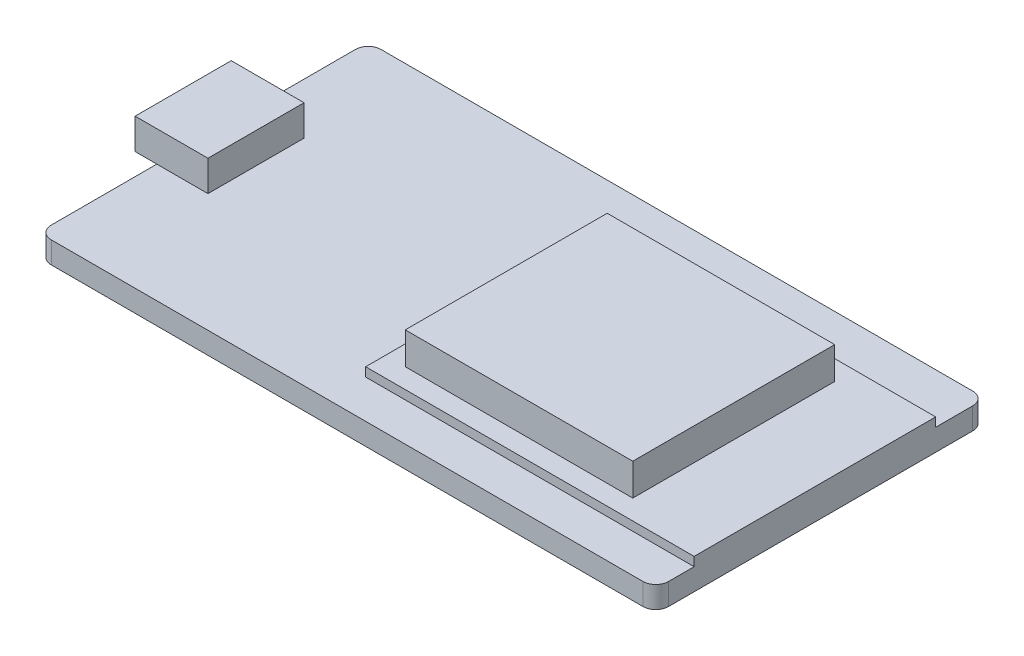
from build123d import *

# Parameters (mm, degrees)
CROQUIS1_W              = 48.3
CROQUIS1_H              = 25.8
SALIENTE_EXTRUIR1_DEPTH = 1.7
CROQUIS2_W              = 25.7
CROQUIS2_H              = 18.9
SALIENTE_EXTRUIR2_DEPTH = 0.7
CROQUIS3_W              = 17.8
CROQUIS3_H              = 15.8
SALIENTE_EXTRUIR3_DEPTH = 2.5
CROQUIS4_W              = 5.7
CROQUIS4_H              = 7.52
SALIENTE_EXTRUIR4_DEPTH = 2.4
REDONDEO1_R             = 1


with BuildPart() as part:
    # Croquis1 → Saliente-Extruir1 (new body)
    with BuildSketch(Plane(origin=(0, 0, 0), x_dir=(1, 0, 0), z_dir=(0, 1, 0))):
        Rectangle(CROQUIS1_W, CROQUIS1_H)
    extrude(amount=SALIENTE_EXTRUIR1_DEPTH)

    # Croquis2 → Saliente-Extruir2 (add)
    with BuildSketch(Plane(origin=(0, 1.7, 0), x_dir=(1, 0, 0), z_dir=(0, 1, 0))):
        with Locations((11.3, -0.45)):
            Rectangle(CROQUIS2_W, CROQUIS2_H)
    extrude(amount=SALIENTE_EXTRUIR2_DEPTH)

    # Croquis3 → Saliente-Extruir3 (add)
    with BuildSketch(Plane(origin=(0, 2.4, 0), x_dir=(1, 0, 0), z_dir=(0, 1, 0))):
        with Locations((8.9, -0.45)):
            Rectangle(CROQUIS3_W, CROQUIS3_H)
    extrude(amount=SALIENTE_EXTRUIR3_DEPTH)

    # Croquis4 → Saliente-Extruir4 (add)
    with BuildSketch(Plane(origin=(0, 1.7, 0), x_dir=(1, 0, 0), z_dir=(0, 1, 0))):
        with Locations((-23, 0.12)):
            Rectangle(CROQUIS4_W, CROQUIS4_H)
    extrude(amount=SALIENTE_EXTRUIR4_DEPTH)

    # Redondeo1
    redondeo1_edges = [part.edges().sort_by_distance(p)[0] for p in [
        (24.15, 0.85, 12.9),
        (-24.15, 0.85, 12.9),
        (-24.15, 0.85, -12.9),
        (24.15, 0.85, -12.9),
    ]]
    fillet(redondeo1_edges, radius=REDONDEO1_R)


solid = part.part
